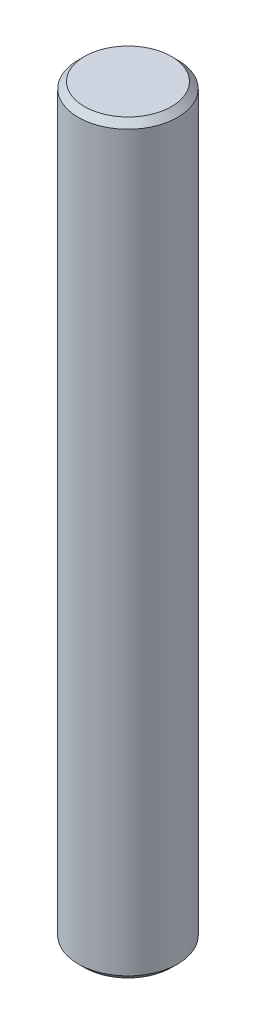
from build123d import *

# Parameters (mm, degrees)
SKETCH1_R           = 2
BOSS_EXTRUDE1_DEPTH = 15
CHAMFER1_SIZE       = 0.25


with BuildPart() as part:
    # Sketch1 → Boss-Extrude1 (new, symmetric)
    with BuildSketch(Plane(origin=(0, 0, 0), x_dir=(1, 0, 0), z_dir=(0, 1, 0))):
        with Locations(Location((0, 0, 0), (0, 0, 270))):
            Circle(SKETCH1_R)
    extrude(amount=BOSS_EXTRUDE1_DEPTH, both=True)

    # Chamfer1
    chamfer1_edges = [part.edges().sort_by_distance(p)[0] for p in [
        (0, -15, -2),
        (0, 15, -2),
    ]]
    chamfer(chamfer1_edges, length=CHAMFER1_SIZE)


solid = part.part
